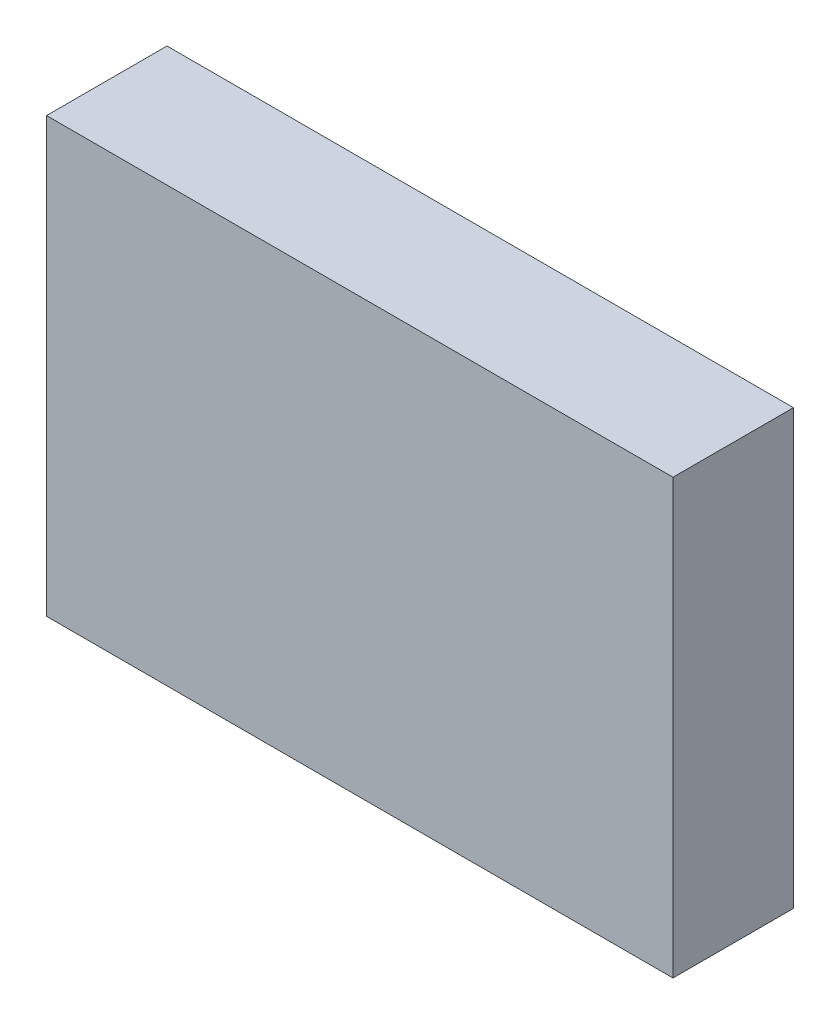
from build123d import *

# Parameters (mm, degrees)
SKETCH1_W           = 26
SKETCH1_H           = 18
BOSS_EXTRUDE1_DEPTH = 5


with BuildPart() as part:
    # Sketch1 → Boss-Extrude1 (new body)
    with BuildSketch(Plane.XY):
        Rectangle(SKETCH1_W, SKETCH1_H)
    extrude(amount=BOSS_EXTRUDE1_DEPTH)


solid = part.part
